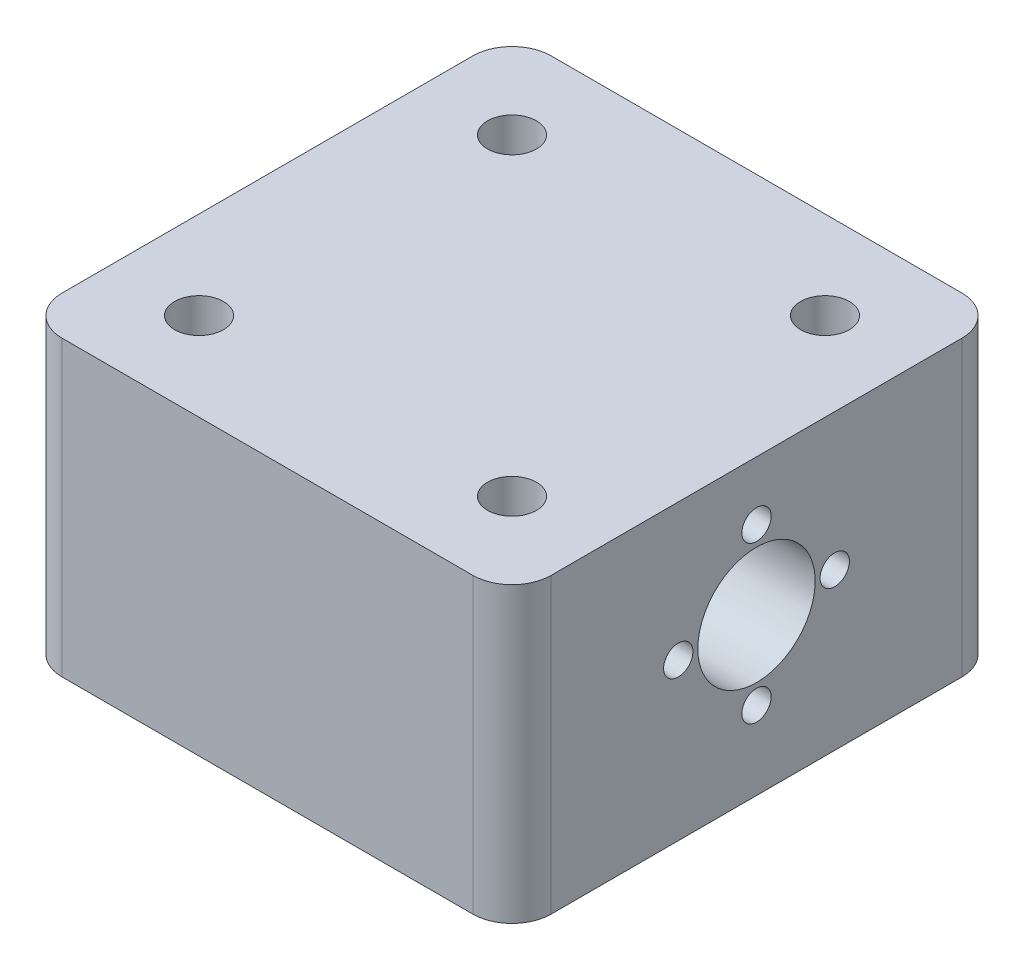
from build123d import *

# Parameters (mm, degrees)
SKETCH1_W           = 50
SKETCH1_H           = 50
BOSS_EXTRUDE1_DEPTH = 30
SKETCH2_R           = 2.5
CUT_EXTRUDE1_DEPTH  = 15
CUT_EXTRUDE2_REACH  = 65.443
SKETCH4_R           = 6
SKETCH5_R           = 1.5
CUT_EXTRUDE3_DEPTH  = 10
CUT_EXTRUDE4_START  = -10
SKETCH6_R           = 1.5
CUT_EXTRUDE4_DEPTH  = 10
FILLET1_R           = 4
SKETCH8_R           = 2.5
CUT_EXTRUDE5_DEPTH  = 15


with BuildPart() as part:
    # Sketch1 → Boss-Extrude1 (new body)
    with BuildSketch(Plane(origin=(0, 0, 0), x_dir=(1, 0, 0), z_dir=(0, 1, 0))):
        Rectangle(SKETCH1_W, SKETCH1_H)
    extrude(amount=BOSS_EXTRUDE1_DEPTH)

    # Sketch2 → Cut-Extrude1 (cut)
    with BuildSketch(Plane.XZ):
        with Locations(Location((0, 10, 0), (0, 0, 270))):
            Circle(SKETCH2_R)
        with Locations(Location((0, -10, 0), (0, 0, 270))):
            Circle(SKETCH2_R)
        with Locations(Location((10, 0, 0), (0, 0, 270))):
            Circle(SKETCH2_R)
        with Locations(Location((-10, 0, 0), (0, 0, 270))):
            Circle(SKETCH2_R)
        with Locations(Location((0, 0, 0), (0, 0, 270))):
            Circle(SKETCH2_R)
    extrude(amount=-CUT_EXTRUDE1_DEPTH, mode=Mode.SUBTRACT)

    # Sketch4 → Cut-Extrude2 (cut, up to next)
    with BuildSketch(Plane.ZY.offset(25), mode=Mode.PRIVATE) as cut_extrude2_sk1:
        with Locations((0, 16)):
            Circle(SKETCH4_R)
    cut_extrude2_tool1 = extrude(cut_extrude2_sk1.sketch, amount=-CUT_EXTRUDE2_REACH, mode=Mode.PRIVATE) & part.part
    add(cut_extrude2_tool1.solids().sort_by_distance((-25, 16, 0))[0], mode=Mode.SUBTRACT)

    # Sketch5 → Cut-Extrude3 (cut)
    with BuildSketch(Plane.ZY.offset(25)):
        with Locations((-8, 16)):
            Circle(SKETCH5_R)
        with Locations((8, 16)):
            Circle(SKETCH5_R)
        with Locations((0, 8)):
            Circle(SKETCH5_R)
        with Locations((0, 24)):
            Circle(SKETCH5_R)
    extrude(amount=-CUT_EXTRUDE3_DEPTH, mode=Mode.SUBTRACT)

    # Sketch6 → Cut-Extrude4 (cut)
    with BuildSketch(Plane(origin=(25, 0, 0), x_dir=(0, 0, -1), z_dir=(1, 0, 0)).offset(CUT_EXTRUDE4_START)):
        with Locations(Location((-8, 16, 0), (0, 0, 180))):
            Circle(SKETCH6_R)
        with Locations(Location((8, 16, 0), (0, 0, 180))):
            Circle(SKETCH6_R)
        with Locations(Location((0, 24, 0), (0, 0, 180))):
            Circle(SKETCH6_R)
        with Locations(Location((0, 8, 0), (0, 0, 180))):
            Circle(SKETCH6_R)
    extrude(amount=CUT_EXTRUDE4_DEPTH, mode=Mode.SUBTRACT)

    # Fillet1
    fillet1_edges = [part.edges().sort_by_distance(p)[0] for p in [
        (25, 15, 25),
        (-25, 15, 25),
        (-25, 15, -25),
        (25, 15, -25),
    ]]
    fillet(fillet1_edges, radius=FILLET1_R)

    # Sketch8 → Cut-Extrude5 (cut)
    with BuildSketch(Plane(origin=(0, 30, 0), x_dir=(1, 0, 0), z_dir=(0, 1, 0))):
        with Locations(Location((-16, 16, 0), (0, 0, 270))):
            Circle(SKETCH8_R)
        with Locations(Location((16, 16, 0), (0, 0, 270))):
            Circle(SKETCH8_R)
        with Locations(Location((16, -16, 0), (0, 0, 270))):
            Circle(SKETCH8_R)
        with Locations(Location((-16, -16, 0), (0, 0, 270))):
            Circle(SKETCH8_R)
    extrude(amount=-CUT_EXTRUDE5_DEPTH, mode=Mode.SUBTRACT)


solid = part.part
